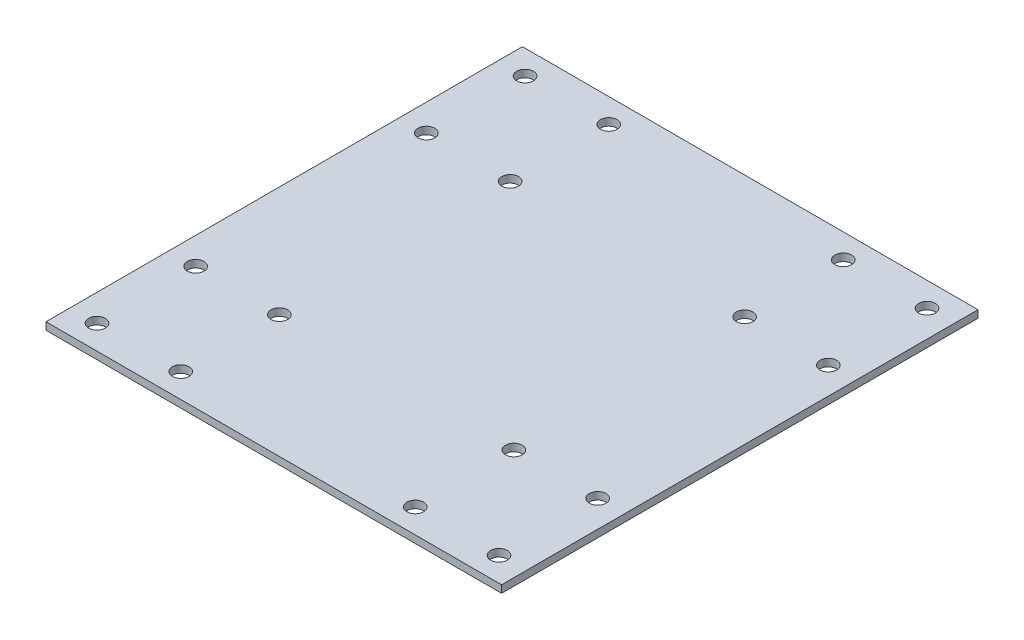
from build123d import *

# Parameters (mm, degrees)
SKETCH2_W           = 388.62
SKETCH2_H           = 406.4
BOSS_EXTRUDE1_DEPTH = 6.35
SKETCH3_R           = 7.14375
CUT_EXTRUDE1_DEPTH  = 282.224000754


with BuildPart() as part:
    # Sketch2 → Boss-Extrude1 (new body)
    with BuildSketch(Plane(origin=(0, 0, 0), x_dir=(1, 0, 0), z_dir=(0, 1, 0))):
        Rectangle(SKETCH2_W, SKETCH2_H)
    extrude(amount=BOSS_EXTRUDE1_DEPTH)

    # Sketch3 → Cut-Extrude1 (cut, through all)
    with BuildSketch(Plane(origin=(0, 6.35, 0), x_dir=(1, 0, 0), z_dir=(0, 1, 0))):
        with Locations(Location((-171.45, -182.5625, 0), (0, 0, 270))):
            Circle(SKETCH3_R)
        with Locations(Location((-100.0125, 182.5625, 0), (0, 0, 270))):
            Circle(SKETCH3_R)
        with Locations(Location((100.0125, -182.5625, 0), (0, 0, 270))):
            Circle(SKETCH3_R)
        with Locations(Location((171.45, -182.5625, 0), (0, 0, 270))):
            Circle(SKETCH3_R)
        with Locations(Location((-171.45, 182.5625, 0), (0, 0, 270))):
            Circle(SKETCH3_R)
        with Locations(Location((-171.45, 98.425, 0), (0, 0, 270))):
            Circle(SKETCH3_R)
        with Locations(Location((100.0125, 182.5625, 0), (0, 0, 270))):
            Circle(SKETCH3_R)
        with Locations(Location((171.45, 182.5625, 0), (0, 0, 270))):
            Circle(SKETCH3_R)
        with Locations(Location((-100.0125, -182.5625, 0), (0, 0, 270))):
            Circle(SKETCH3_R)
        with Locations(Location((-171.45, -98.425, 0), (0, 0, 270))):
            Circle(SKETCH3_R)
        with Locations(Location((-100.0125, -98.425, 0), (0, 0, 270))):
            Circle(SKETCH3_R)
        with Locations(Location((-100.0125, 98.425, 0), (0, 0, 270))):
            Circle(SKETCH3_R)
        with Locations(Location((100.0125, 98.425, 0), (0, 0, 270))):
            Circle(SKETCH3_R)
        with Locations(Location((171.45, 98.425, 0), (0, 0, 270))):
            Circle(SKETCH3_R)
        with Locations(Location((100.0125, -98.425, 0), (0, 0, 270))):
            Circle(SKETCH3_R)
        with Locations(Location((171.45, -98.425, 0), (0, 0, 270))):
            Circle(SKETCH3_R)
    extrude(amount=-CUT_EXTRUDE1_DEPTH, mode=Mode.SUBTRACT)


solid = part.part
